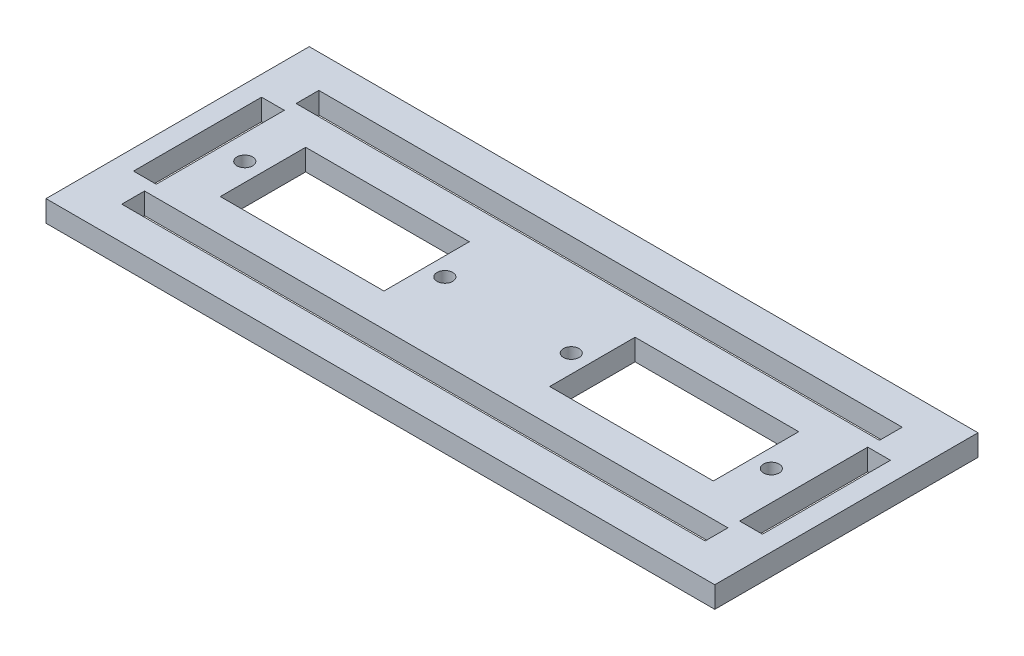
from build123d import *

# Parameters (mm, degrees)
ESBO_O1_W                = 94
ESBO_O1_H                = 37
RESSALTO_EXTRUS_O1_DEPTH = 3
ESBO_O2_W                = 82
ESBO_O2_H                = 3.2
ESBO_O2_W_2              = 3.2
ESBO_O2_H_2              = 18
CORTE_EXTRUS_O2_DEPTH    = 3
ESBO_O2_5_R              = 1.1
ESBO_O2_5_W              = 82
ESBO_O2_5_H              = 3.2
ESBO_O2_5_W_2            = 3.2
ESBO_O2_5_H_2            = 18
ESBO_O2_5_W_3            = 23
ESBO_O2_5_H_3            = 12
CORTE_EXTRUS_O4_DEPTH    = 10


with BuildPart() as part:
    # Esboço1 → Ressalto-extrusão1 (new body)
    with BuildSketch(Plane(origin=(0, 0, 0), x_dir=(1, 0, 0), z_dir=(0, 1, 0))):
        with Locations((15.423867314, 16.168005002)):
            Rectangle(ESBO_O1_W, ESBO_O1_H)
    extrude(amount=RESSALTO_EXTRUS_O1_DEPTH)

    # Esboço2 → Corte-extrusão2 (cut)
    with BuildSketch(Plane(origin=(0, 3, 0), x_dir=(1, 0, 0), z_dir=(0, 1, 0))):
        with Locations((15.423867314, 3.918005002)):
            Rectangle(ESBO_O2_W, ESBO_O2_H)
        with Locations((15.423867314, 28.418005002)):
            Rectangle(ESBO_O2_W, ESBO_O2_H)
        with Locations((-27.176132686, 16.168005002)):
            Rectangle(ESBO_O2_W_2, ESBO_O2_H_2)
    extrude(amount=-CORTE_EXTRUS_O2_DEPTH, mode=Mode.SUBTRACT)

    # Esboço2<5> → Corte-extrusão4 (cut)
    with BuildSketch(Plane(origin=(0, 3, 0), x_dir=(1, 0, 0), z_dir=(0, 1, 0))):
        with Locations((5.983867314, 16.168005002)):
            Circle(ESBO_O2_5_R)
        with Locations((-22.136132686, 16.168005002)):
            Circle(ESBO_O2_5_R)
        with Locations((52.25559416, 15.786516757)):
            Circle(ESBO_O2_5_R)
        with Locations((24.13559416, 15.786516757)):
            Circle(ESBO_O2_5_R)
        with Locations((15.423867314, 3.918005002)):
            Rectangle(ESBO_O2_5_W, ESBO_O2_5_H)
        with Locations((15.423867314, 28.418005002)):
            Rectangle(ESBO_O2_5_W, ESBO_O2_5_H)
        with Locations((-27.176132686, 16.168005002)):
            Rectangle(ESBO_O2_5_W_2, ESBO_O2_5_H_2)
        with Locations((-8.076132686, 16.168005002)):
            Rectangle(ESBO_O2_5_W_3, ESBO_O2_5_H_3)
        with Locations((58.023867314, 16.168005002)):
            Rectangle(ESBO_O2_5_W_2, ESBO_O2_5_H_2)
        with Locations((38.19559416, 16.196023894)):
            Rectangle(ESBO_O2_5_W_3, ESBO_O2_5_H_3)
    extrude(amount=-CORTE_EXTRUS_O4_DEPTH, mode=Mode.SUBTRACT)


solid = part.part
